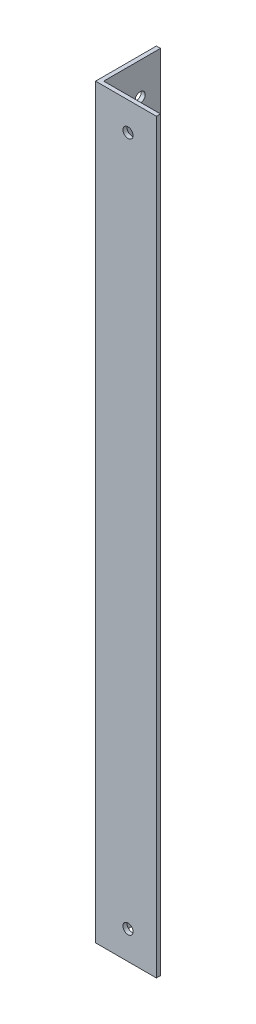
from build123d import *

# Parameters (mm, degrees)
SKETCH_1_W      = 15
SKETCH_1_H      = 1
EXTRUDE_1_DEPTH = 184
SKETCH_3_W      = 1
SKETCH_3_H      = 184
EXTRUDE_2_DEPTH = 14
M3X0_5_1_D      = 2.5
M3X0_5_2_D      = 2.5


with BuildPart() as part:
    # ｽｹｯﾁ1 → ﾎﾞｽ - 押し出し1 (new body)
    with BuildSketch(Plane(origin=(0, 0, 0), x_dir=(1, 0, 0), z_dir=(0, 1, 0))):
        with Locations((7.5, -0.5)):
            Rectangle(SKETCH_1_W, SKETCH_1_H)
    extrude(amount=EXTRUDE_1_DEPTH)

    # ｽｹｯﾁ3 → ﾎﾞｽ - 押し出し2 (add)
    with BuildSketch(Plane(origin=(0, 0, 0), x_dir=(-1, 0, 0), z_dir=(0, 0, -1))):
        with Locations((-0.5, 92)):
            Rectangle(SKETCH_3_W, SKETCH_3_H)
    extrude(amount=EXTRUDE_2_DEPTH)

    # M3x0.5 ねじ穴1 (through all)
    with Locations(Plane.ZY):
        with Locations((-9, 8), (-9, 176)):
            Hole(M3X0_5_1_D / 2)

    # M3x0.5 ねじ穴2 (through all)
    with Locations(Plane.XY.offset(1)):
        with Locations((8, 7), (8, 177)):
            Hole(M3X0_5_2_D / 2)


solid = part.part
